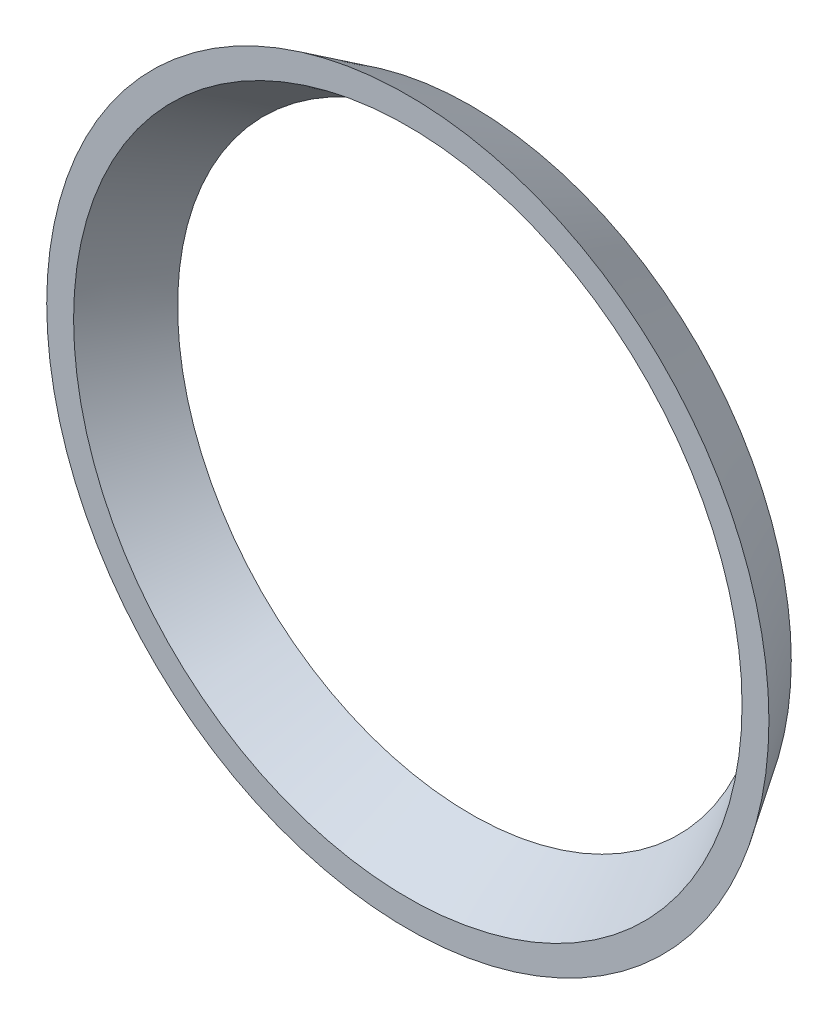
from build123d import *


with BuildPart() as part:
    # Sketch1 → Revolve1 (revolve)
    with BuildSketch(Plane(origin=(0, 0, 0), x_dir=(0, 0, -1), z_dir=(1, 0, 0)), mode=Mode.PRIVATE) as revolve1_sk:
        Polygon((0, 18.51172162), (3.5, 16.25), (3.5, 17.73827838), (0, 20), align=None)
    revolve(revolve1_sk.sketch.rotate(Axis((0, 0, 0), (0, 0, -1)), 90), axis=Axis((0, 0, 0), (0, 0, -1)))


solid = part.part
